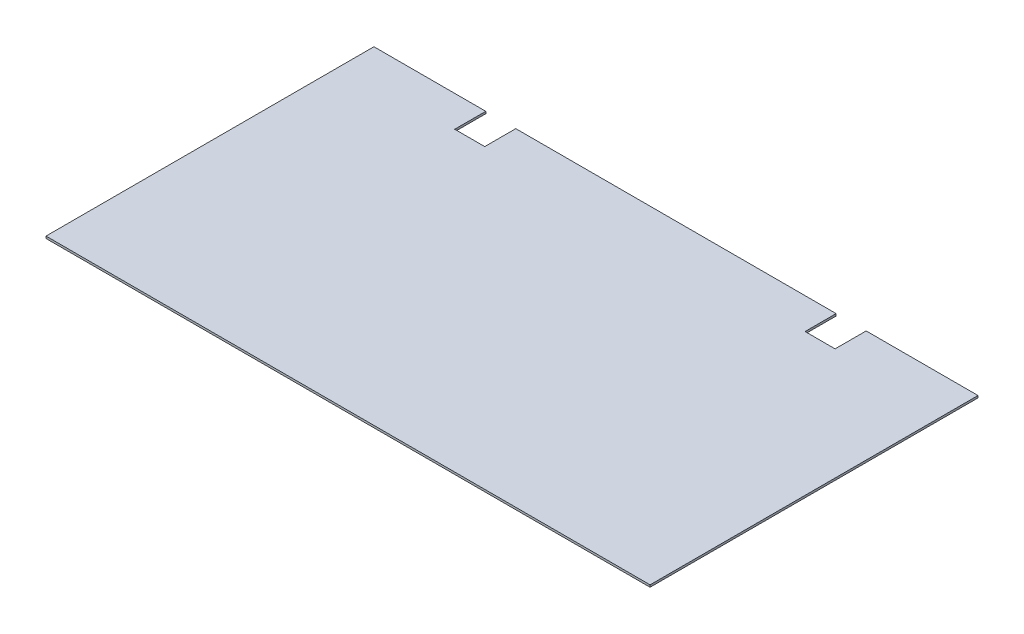
from build123d import *

# Parameters (mm, degrees)
SKETCH1_W           = 444.5
SKETCH1_H           = 241.3
BOSS_EXTRUDE1_DEPTH = 1.5621
CUT_EXTRUDE1_REACH  = 254.891
SKETCH2_W           = 22.098
SKETCH2_H           = 22.86


with BuildPart() as part:
    # Sketch1 → Boss-Extrude1 (new body)
    with BuildSketch(Plane(origin=(0, 0, 0), x_dir=(1, 0, 0), z_dir=(0, 1, 0))):
        Rectangle(SKETCH1_W, SKETCH1_H)
    extrude(amount=BOSS_EXTRUDE1_DEPTH)

    # Sketch2 → Cut-Extrude1 (cut, up to next)
    with BuildSketch(Plane(origin=(0, 1.5621, 0), x_dir=(1, 0, 0), z_dir=(0, 1, 0)), mode=Mode.PRIVATE) as cut_extrude1_sk1:
        with Locations((-128.905, 109.22)):
            Rectangle(SKETCH2_W, SKETCH2_H)
    cut_extrude1_tool1 = extrude(cut_extrude1_sk1.sketch, amount=-CUT_EXTRUDE1_REACH, mode=Mode.PRIVATE) & part.part
    # Sketch2 → Cut-Extrude1 (cut, up to next)
    with BuildSketch(Plane(origin=(0, 1.5621, 0), x_dir=(1, 0, 0), z_dir=(0, 1, 0)), mode=Mode.PRIVATE) as cut_extrude1_sk2:
        with Locations((128.905, 109.22)):
            Rectangle(SKETCH2_W, SKETCH2_H)
    cut_extrude1_tool2 = extrude(cut_extrude1_sk2.sketch, amount=-CUT_EXTRUDE1_REACH, mode=Mode.PRIVATE) & part.part
    add(cut_extrude1_tool1.solids().sort_by_distance((-128.905, 1.5621, -109.22))[0], mode=Mode.SUBTRACT)
    add(cut_extrude1_tool2.solids().sort_by_distance((128.905, 1.5621, -109.22))[0], mode=Mode.SUBTRACT)


solid = part.part
